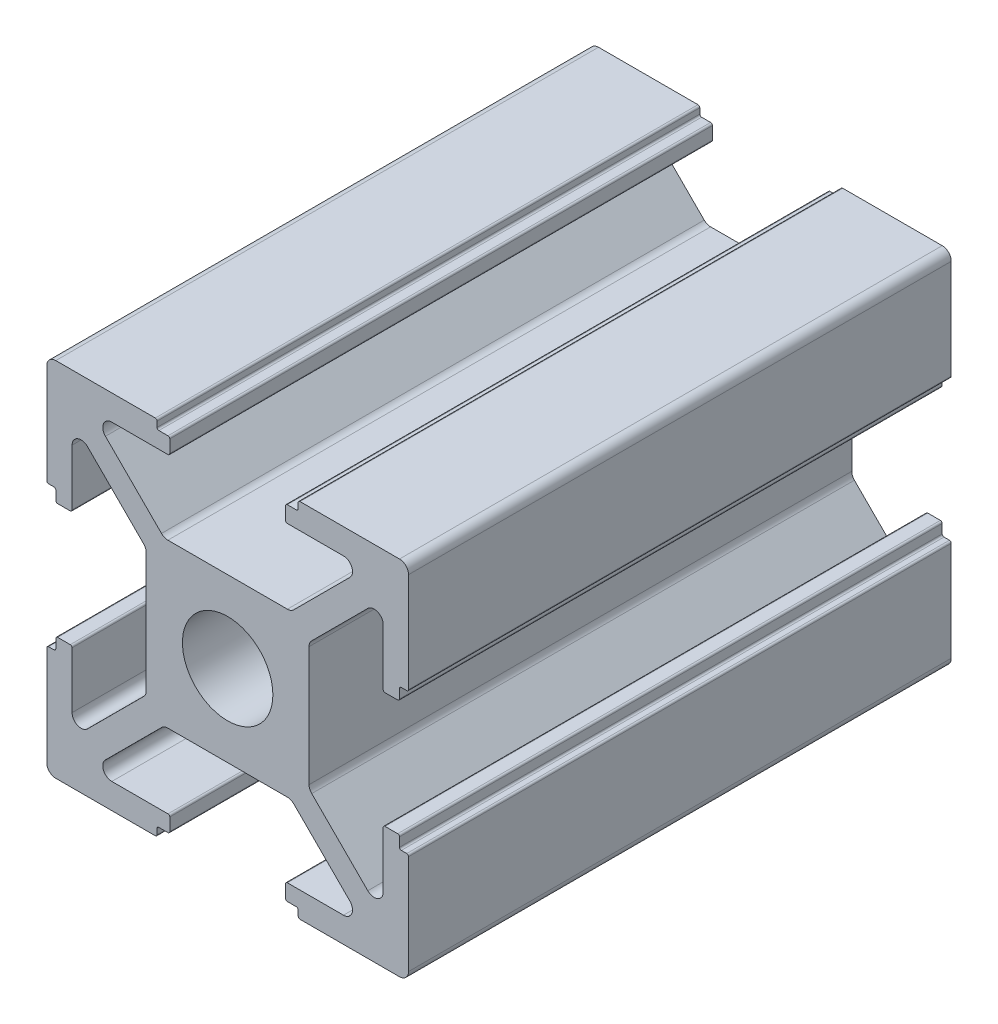
from build123d import *

# Parameters (mm, degrees)
IZIM1_R                     = 2.5
Y_KSEKLIK_EKSTR_ZYON1_DEPTH = 30


with BuildPart() as part:
    # Çizim1 → Yükseklik-Ekstrüzyon1 (new body)
    with BuildSketch(Plane.XY):
        with BuildLine():
            Line((8.6, 3.3), (8.6, 6.402943725))
            ThreePointArc((8.6, 6.402943725), (8.291341716, 6.864883491), (7.746446609, 6.756497116))
            Line((7.746446609, 6.756497116), (4.646446609, 3.656497116))
            ThreePointArc((4.646446609, 3.656497116), (4.538060234, 3.494285441), (4.5, 3.302943725))
            Line((4.5, 3.302943725), (4.5, 0))
            Line((4.5, 0), (4.5, -3.302943725))
            ThreePointArc((4.5, -3.302943725), (4.538060234, -3.494285441), (4.646446609, -3.656497116))
            Line((4.646446609, -3.656497116), (7.746446609, -6.756497116))
            ThreePointArc((7.746446609, -6.756497116), (8.291341716, -6.864883491), (8.6, -6.402943725))
            Line((8.6, -6.402943725), (8.6, -3.3))
            ThreePointArc((8.6, -3.3), (8.629289322, -3.229289322), (8.7, -3.2))
            Line((8.7, -3.2), (9.4, -3.2))
            ThreePointArc((9.4, -3.2), (9.470710678, -3.229289322), (9.5, -3.3))
            Line((9.5, -3.3), (9.5, -3.8))
            ThreePointArc((9.5, -3.8), (9.529289322, -3.870710678), (9.6, -3.9))
            Line((9.6, -3.9), (9.9, -3.9))
            ThreePointArc((9.9, -3.9), (9.970710678, -3.929289322), (10, -4))
            Line((10, -4), (10, -9.5))
            ThreePointArc((10, -9.5), (9.853553391, -9.853553391), (9.5, -10))
            Line((9.5, -10), (4, -10))
            ThreePointArc((4, -10), (3.929289322, -9.970710678), (3.9, -9.9))
            Line((3.9, -9.9), (3.9, -9.6))
            ThreePointArc((3.9, -9.6), (3.870710678, -9.529289322), (3.8, -9.5))
            Line((3.8, -9.5), (3.3, -9.5))
            ThreePointArc((3.3, -9.5), (3.229289322, -9.470710678), (3.2, -9.4))
            Line((3.2, -9.4), (3.2, -8.7))
            ThreePointArc((3.2, -8.7), (3.229289322, -8.629289322), (3.3, -8.6))
            Line((3.3, -8.6), (6.402943725, -8.6))
            ThreePointArc((6.402943725, -8.6), (6.864883491, -8.291341716), (6.756497116, -7.746446609))
            Line((6.756497116, -7.746446609), (3.656497116, -4.646446609))
            ThreePointArc((3.656497116, -4.646446609), (3.494285441, -4.538060234), (3.302943725, -4.5))
            Line((3.302943725, -4.5), (0, -4.5))
            Line((0, -4.5), (-3.302943725, -4.5))
            ThreePointArc((-3.302943725, -4.5), (-3.494285441, -4.538060234), (-3.656497116, -4.646446609))
            Line((-3.656497116, -4.646446609), (-6.756497116, -7.746446609))
            ThreePointArc((-6.756497116, -7.746446609), (-6.864883491, -8.291341716), (-6.402943725, -8.6))
            Line((-6.402943725, -8.6), (-3.3, -8.6))
            ThreePointArc((-3.3, -8.6), (-3.229289322, -8.629289322), (-3.2, -8.7))
            Line((-3.2, -8.7), (-3.2, -9.4))
            ThreePointArc((-3.2, -9.4), (-3.229289322, -9.470710678), (-3.3, -9.5))
            Line((-3.3, -9.5), (-3.8, -9.5))
            ThreePointArc((-3.8, -9.5), (-3.870710678, -9.529289322), (-3.9, -9.6))
            Line((-3.9, -9.6), (-3.9, -9.9))
            ThreePointArc((-3.9, -9.9), (-3.929289322, -9.970710678), (-4, -10))
            Line((-4, -10), (-9.5, -10))
            ThreePointArc((-9.5, -10), (-9.853553391, -9.853553391), (-10, -9.5))
            Line((-10, -9.5), (-10, -4))
            ThreePointArc((-10, -4), (-9.970710678, -3.929289322), (-9.9, -3.9))
            Line((-9.9, -3.9), (-9.6, -3.9))
            ThreePointArc((-9.6, -3.9), (-9.529289322, -3.870710678), (-9.5, -3.8))
            Line((-9.5, -3.8), (-9.5, -3.3))
            ThreePointArc((-9.5, -3.3), (-9.470710678, -3.229289322), (-9.4, -3.2))
            Line((-9.4, -3.2), (-8.7, -3.2))
            ThreePointArc((-8.7, -3.2), (-8.629289322, -3.229289322), (-8.6, -3.3))
            Line((-8.6, -3.3), (-8.6, -6.402943725))
            ThreePointArc((-8.6, -6.402943725), (-8.291341716, -6.864883491), (-7.746446609, -6.756497116))
            Line((-7.746446609, -6.756497116), (-4.646446609, -3.656497116))
            ThreePointArc((-4.646446609, -3.656497116), (-4.538060234, -3.494285441), (-4.5, -3.302943725))
            Line((-4.5, -3.302943725), (-4.5, 0))
            Line((-4.5, 0), (-4.5, 3.302943725))
            ThreePointArc((-4.5, 3.302943725), (-4.538060234, 3.494285441), (-4.646446609, 3.656497116))
            Line((-4.646446609, 3.656497116), (-7.746446609, 6.756497116))
            ThreePointArc((-7.746446609, 6.756497116), (-8.291341716, 6.864883491), (-8.6, 6.402943725))
            Line((-8.6, 6.402943725), (-8.6, 3.3))
            ThreePointArc((-8.6, 3.3), (-8.629289322, 3.229289322), (-8.7, 3.2))
            Line((-8.7, 3.2), (-9.4, 3.2))
            ThreePointArc((-9.4, 3.2), (-9.470710678, 3.229289322), (-9.5, 3.3))
            Line((-9.5, 3.3), (-9.5, 3.8))
            ThreePointArc((-9.5, 3.8), (-9.529289322, 3.870710678), (-9.6, 3.9))
            Line((-9.6, 3.9), (-9.9, 3.9))
            ThreePointArc((-9.9, 3.9), (-9.970710678, 3.929289322), (-10, 4))
            Line((-10, 4), (-10, 9.5))
            ThreePointArc((-10, 9.5), (-9.853553391, 9.853553391), (-9.5, 10))
            Line((-9.5, 10), (-4, 10))
            ThreePointArc((-4, 10), (-3.929289322, 9.970710678), (-3.9, 9.9))
            Line((-3.9, 9.9), (-3.9, 9.6))
            ThreePointArc((-3.9, 9.6), (-3.870710678, 9.529289322), (-3.8, 9.5))
            Line((-3.8, 9.5), (-3.3, 9.5))
            ThreePointArc((-3.3, 9.5), (-3.229289322, 9.470710678), (-3.2, 9.4))
            Line((-3.2, 9.4), (-3.2, 8.7))
            ThreePointArc((-3.2, 8.7), (-3.229289322, 8.629289322), (-3.3, 8.6))
            Line((-3.3, 8.6), (-6.402943725, 8.6))
            ThreePointArc((-6.402943725, 8.6), (-6.864883491, 8.291341716), (-6.756497116, 7.746446609))
            Line((-6.756497116, 7.746446609), (-3.656497116, 4.646446609))
            ThreePointArc((-3.656497116, 4.646446609), (-3.494285441, 4.538060234), (-3.302943725, 4.5))
            Line((-3.302943725, 4.5), (0, 4.5))
            Line((0, 4.5), (3.302943725, 4.5))
            ThreePointArc((3.302943725, 4.5), (3.494285441, 4.538060234), (3.656497116, 4.646446609))
            Line((3.656497116, 4.646446609), (6.756497116, 7.746446609))
            ThreePointArc((6.756497116, 7.746446609), (6.864883491, 8.291341716), (6.402943725, 8.6))
            Line((6.402943725, 8.6), (3.3, 8.6))
            ThreePointArc((3.3, 8.6), (3.229289322, 8.629289322), (3.2, 8.7))
            Line((3.2, 8.7), (3.2, 9.4))
            ThreePointArc((3.2, 9.4), (3.229289322, 9.470710678), (3.3, 9.5))
            Line((3.3, 9.5), (3.8, 9.5))
            ThreePointArc((3.8, 9.5), (3.870710678, 9.529289322), (3.9, 9.6))
            Line((3.9, 9.6), (3.9, 9.9))
            ThreePointArc((3.9, 9.9), (3.929289322, 9.970710678), (4, 10))
            Line((4, 10), (9.5, 10))
            ThreePointArc((9.5, 10), (9.853553391, 9.853553391), (10, 9.5))
            Line((10, 9.5), (10, 4))
            ThreePointArc((10, 4), (9.970710678, 3.929289322), (9.9, 3.9))
            Line((9.9, 3.9), (9.6, 3.9))
            ThreePointArc((9.6, 3.9), (9.529289322, 3.870710678), (9.5, 3.8))
            Line((9.5, 3.8), (9.5, 3.3))
            ThreePointArc((9.5, 3.3), (9.470710678, 3.229289322), (9.4, 3.2))
            Line((9.4, 3.2), (8.7, 3.2))
            ThreePointArc((8.7, 3.2), (8.629289322, 3.229289322), (8.6, 3.3))
        make_face()
        Circle(IZIM1_R, mode=Mode.SUBTRACT)
    extrude(amount=Y_KSEKLIK_EKSTR_ZYON1_DEPTH)


solid = part.part
